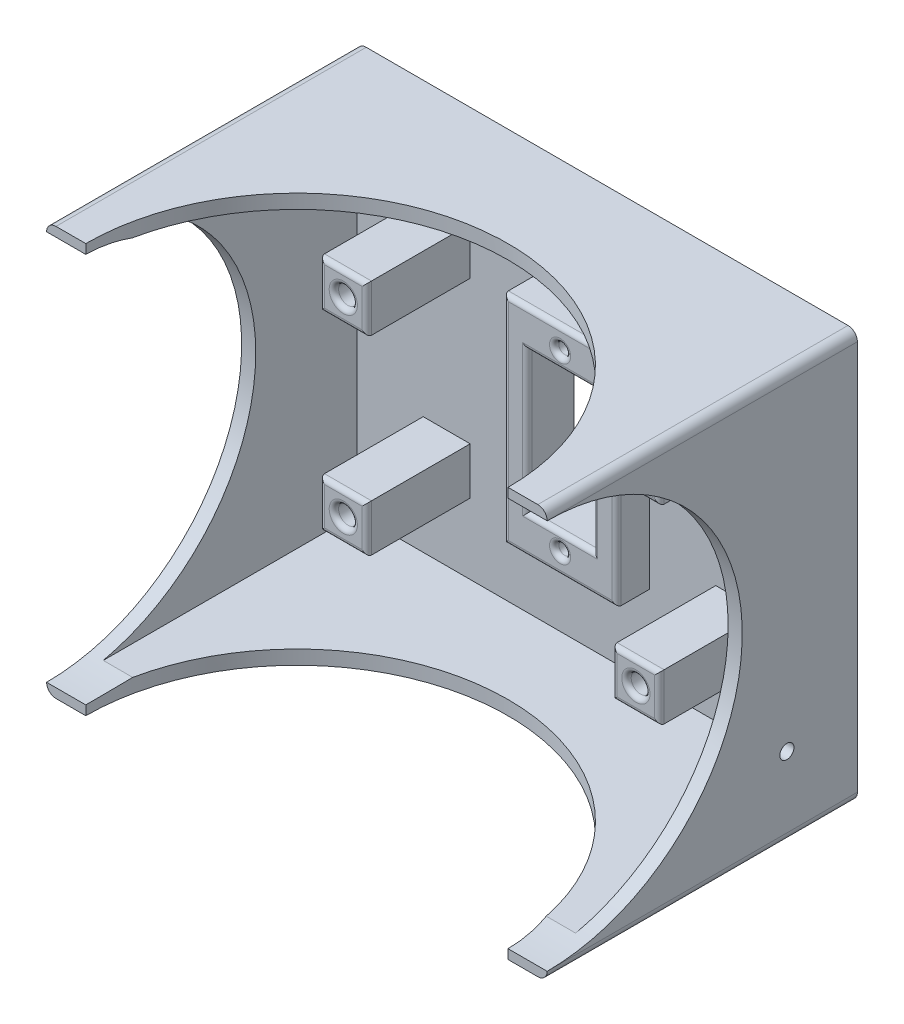
from build123d import *

# Parameters (mm, degrees)
ESQUISSE1_W             = 106.505
ESQUISSE1_H             = 87
ESQUISSE1_W_2           = 100.505
ESQUISSE1_H_2           = 81
BOSS_EXTRU_1_DEPTH      = 66
ESQUISSE1_35_W          = 100.505
ESQUISSE1_35_H          = 81
ESQUISSE1_35_W_2        = 10
ESQUISSE1_35_H_2        = 10
ESQUISSE1_35_W_3        = 24
ESQUISSE1_35_H_3        = 46
BOSS_EXTRU_2_DEPTH      = 3
CONG_1_R                = 2
CONG_2_R                = 2
CONG_4_R                = 2
CONG_5_R                = 2
ESQUISSE3_R             = 44.917746465
ENL_V_MAT_EXTRU_2_DEPTH = 111
ESQUISSE4_R             = 41.5
ENL_V_MAT_EXTRU_3_DEPTH = 111
ESQUISSE5_R             = 1.5
ENL_V_MAT_EXTRU_6_DEPTH = 5
ESQUISSE8_R             = 1.5
ENL_V_MAT_EXTRU_7_DEPTH = 15
ESQUISSE1_44_W          = 24
ESQUISSE1_44_H          = 46
ESQUISSE1_44_R          = 1.25
ESQUISSE1_44_W_2        = 14
ESQUISSE1_44_H_2        = 30
BOSS_EXTRU_9_DEPTH      = 10
ESQUISSE1_45_W          = 10
ESQUISSE1_45_H          = 10
ESQUISSE1_45_R          = 2
BOSS_EXTRU_10_DEPTH     = 25
ESQUISSE1_46_R          = 2
BOSS_EXTRU_11_DEPTH     = 10
ESQUISSE1_51_R          = 1.25
BOSS_EXTRU_12_DEPTH     = 5
CONG_9_R                = 1
CONG_10_R               = 1


with BuildPart() as part:
    # Esquisse1 → Boss.-Extru.1 (new body)
    with BuildSketch(Plane.XY):
        with Locations((-55.086945802, -28.903873598)):
            Rectangle(ESQUISSE1_W, ESQUISSE1_H)
        with Locations((-55.086945802, -28.903873598)):
            Rectangle(ESQUISSE1_W_2, ESQUISSE1_H_2, mode=Mode.SUBTRACT)
    extrude(amount=BOSS_EXTRU_1_DEPTH)

    # Esquisse1<35> → Boss.-Extru.2 (add)
    with BuildSketch(Plane.XY):
        with Locations((-55.086945802, -28.903873598)):
            Rectangle(ESQUISSE1_35_W, ESQUISSE1_35_H)
        with Locations((-86.214445802, -49.403873598)):
            Rectangle(ESQUISSE1_35_W_2, ESQUISSE1_35_H_2, mode=Mode.SUBTRACT)
        with Locations((-55.089445802, -29.153873598)):
            Rectangle(ESQUISSE1_35_W_3, ESQUISSE1_35_H_3, mode=Mode.SUBTRACT)
        with Locations((-23.964445802, -49.403873598)):
            Rectangle(ESQUISSE1_35_W_2, ESQUISSE1_35_H_2, mode=Mode.SUBTRACT)
        with Locations((-86.214445802, -8.903873598)):
            Rectangle(ESQUISSE1_35_W_2, ESQUISSE1_35_H_2, mode=Mode.SUBTRACT)
        with Locations((-23.964445802, -8.903873598)):
            Rectangle(ESQUISSE1_35_W_2, ESQUISSE1_35_H_2, mode=Mode.SUBTRACT)
    extrude(amount=BOSS_EXTRU_2_DEPTH)

    # Congé1
    cong_1_edges = [part.edges().sort_by_distance(p)[0] for p in [
        (-108.339445802, -72.403873598, 33),
    ]]
    fillet(cong_1_edges, radius=CONG_1_R)

    # Congé2
    cong_2_edges = [part.edges().sort_by_distance(p)[0] for p in [
        (-108.339445802, 14.596126402, 33),
    ]]
    fillet(cong_2_edges, radius=CONG_2_R)

    # Congé4
    cong_4_edges = [part.edges().sort_by_distance(p)[0] for p in [
        (-1.834445802, 14.596126402, 33),
    ]]
    fillet(cong_4_edges, radius=CONG_4_R)

    # Congé5
    cong_5_edges = [part.edges().sort_by_distance(p)[0] for p in [
        (-1.834445802, -72.403873598, 33),
    ]]
    fillet(cong_5_edges, radius=CONG_5_R)

    # Esquisse3 → Enlèv. mat.-Extru.2 (cut)
    with BuildSketch(Plane.XZ.offset(72.403873598)):
        with Locations((-55.086945802, 66)):
            Circle(ESQUISSE3_R)
    extrude(amount=-ENL_V_MAT_EXTRU_2_DEPTH, mode=Mode.SUBTRACT)

    # Esquisse4 → Enlèv. mat.-Extru.3 (cut)
    with BuildSketch(Plane(origin=(-1.834445802, 0, 0), x_dir=(0, 0, -1), z_dir=(1, 0, 0))):
        with Locations((-66, -28.903873598)):
            Circle(ESQUISSE4_R)
    extrude(amount=-ENL_V_MAT_EXTRU_3_DEPTH, mode=Mode.SUBTRACT)

    # Esquisse5 → Enlèv. mat.-Extru.6 (cut)
    with BuildSketch(Plane.ZY.offset(108.339445802)):
        with Locations((15, -2.403873598)):
            Circle(ESQUISSE5_R)
    extrude(amount=-ENL_V_MAT_EXTRU_6_DEPTH, mode=Mode.SUBTRACT)

    # Esquisse8 → Enlèv. mat.-Extru.7 (cut)
    with BuildSketch(Plane(origin=(-1.834445802, 0, 0), x_dir=(0, 0, -1), z_dir=(1, 0, 0))):
        with Locations((-15, -55.403873598)):
            Circle(ESQUISSE8_R)
    extrude(amount=-ENL_V_MAT_EXTRU_7_DEPTH, mode=Mode.SUBTRACT)

    # Esquisse1<44> → Boss.-Extru.9 (add)
    with BuildSketch(Plane.XY):
        with Locations((-55.089445802, -29.153873598)):
            Rectangle(ESQUISSE1_44_W, ESQUISSE1_44_H)
        with Locations((-55.089445802, -47.653873598)):
            Circle(ESQUISSE1_44_R, mode=Mode.SUBTRACT)
        with Locations((-55.089445802, -29.153873598)):
            Rectangle(ESQUISSE1_44_W_2, ESQUISSE1_44_H_2, mode=Mode.SUBTRACT)
        with Locations((-55.089445802, -10.653873598)):
            Circle(ESQUISSE1_44_R, mode=Mode.SUBTRACT)
    extrude(amount=BOSS_EXTRU_9_DEPTH)

    # Esquisse1<45> → Boss.-Extru.10 (add)
    # profile 1 of 4: a face of its own
    with BuildSketch(Plane.XY):
        with Locations((-86.214445802, -8.903873598)):
            Rectangle(ESQUISSE1_45_W, ESQUISSE1_45_H)
        with Locations((-86.214445802, -8.903873598)):
            Circle(ESQUISSE1_45_R, mode=Mode.SUBTRACT)
    # profile 2 of 4: a face of its own
    with BuildSketch(Plane.XY):
        with Locations((-23.964445802, -8.903873598)):
            Rectangle(ESQUISSE1_45_W, ESQUISSE1_45_H)
        with Locations((-23.964445802, -8.903873598)):
            Circle(ESQUISSE1_45_R, mode=Mode.SUBTRACT)
    # profile 3 of 4: a face of its own
    with BuildSketch(Plane.XY):
        with Locations((-23.964445802, -49.403873598)):
            Rectangle(ESQUISSE1_45_W, ESQUISSE1_45_H)
        with Locations((-23.964445802, -49.403873598)):
            Circle(ESQUISSE1_45_R, mode=Mode.SUBTRACT)
    # profile 4 of 4: a face of its own
    with BuildSketch(Plane.XY):
        with Locations((-86.214445802, -49.403873598)):
            Rectangle(ESQUISSE1_45_W, ESQUISSE1_45_H)
        with Locations((-86.214445802, -49.403873598)):
            Circle(ESQUISSE1_45_R, mode=Mode.SUBTRACT)
    extrude(amount=BOSS_EXTRU_10_DEPTH)

    # Esquisse1<46> → Boss.-Extru.11 (add)
    with BuildSketch(Plane.XY):
        with Locations((-86.214445802, -8.903873598)):
            Circle(ESQUISSE1_46_R)
        with Locations((-23.964445802, -8.903873598)):
            Circle(ESQUISSE1_46_R)
        with Locations((-86.214445802, -49.403873598)):
            Circle(ESQUISSE1_46_R)
        with Locations((-23.964445802, -49.403873598)):
            Circle(ESQUISSE1_46_R)
    extrude(amount=BOSS_EXTRU_11_DEPTH)

    # Esquisse1<51> → Boss.-Extru.12 (add)
    with BuildSketch(Plane.XY):
        with Locations((-55.089445802, -47.653873598)):
            Circle(ESQUISSE1_51_R)
        with Locations((-55.089445802, -10.653873598)):
            Circle(ESQUISSE1_51_R)
    extrude(amount=BOSS_EXTRU_12_DEPTH)

    # Congé9
    cong_9_edges = [part.edges().sort_by_distance(p)[0] for p in [
        (-86.214445802, -54.403873598, 25),
        (-91.214445802, -49.403873598, 25),
        (-86.214445802, -44.403873598, 25),
        (-81.214445802, -49.403873598, 25),
        (-88.214445802, -49.403873598, 25),
        (-86.214445802, -13.903873598, 25),
        (-91.214445802, -8.903873598, 25),
        (-86.214445802, -3.903873598, 25),
        (-81.214445802, -8.903873598, 25),
        (-88.214445802, -8.903873598, 25),
        (-23.964445802, -54.403873598, 25),
        (-28.964445802, -49.403873598, 25),
        (-23.964445802, -44.403873598, 25),
        (-18.964445802, -49.403873598, 25),
        (-25.964445802, -49.403873598, 25),
        (-23.964445802, -13.903873598, 25),
        (-28.964445802, -8.903873598, 25),
        (-23.964445802, -3.903873598, 25),
        (-18.964445802, -8.903873598, 25),
        (-25.964445802, -8.903873598, 25),
    ]]
    fillet(cong_9_edges, radius=CONG_9_R)

    # Congé10
    cong_10_edges = [part.edges().sort_by_distance(p)[0] for p in [
        (-67.089445802, -29.153873598, 10),
        (-55.089445802, -6.153873598, 10),
        (-43.089445802, -29.153873598, 10),
        (-55.089445802, -52.153873598, 10),
        (-55.089445802, -44.153873598, 10),
        (-48.089445802, -29.153873598, 10),
        (-55.089445802, -14.153873598, 10),
        (-62.089445802, -29.153873598, 10),
        (-56.339445802, -47.653873598, 10),
        (-56.339445802, -10.653873598, 10),
    ]]
    fillet(cong_10_edges, radius=CONG_10_R)


solid = part.part
